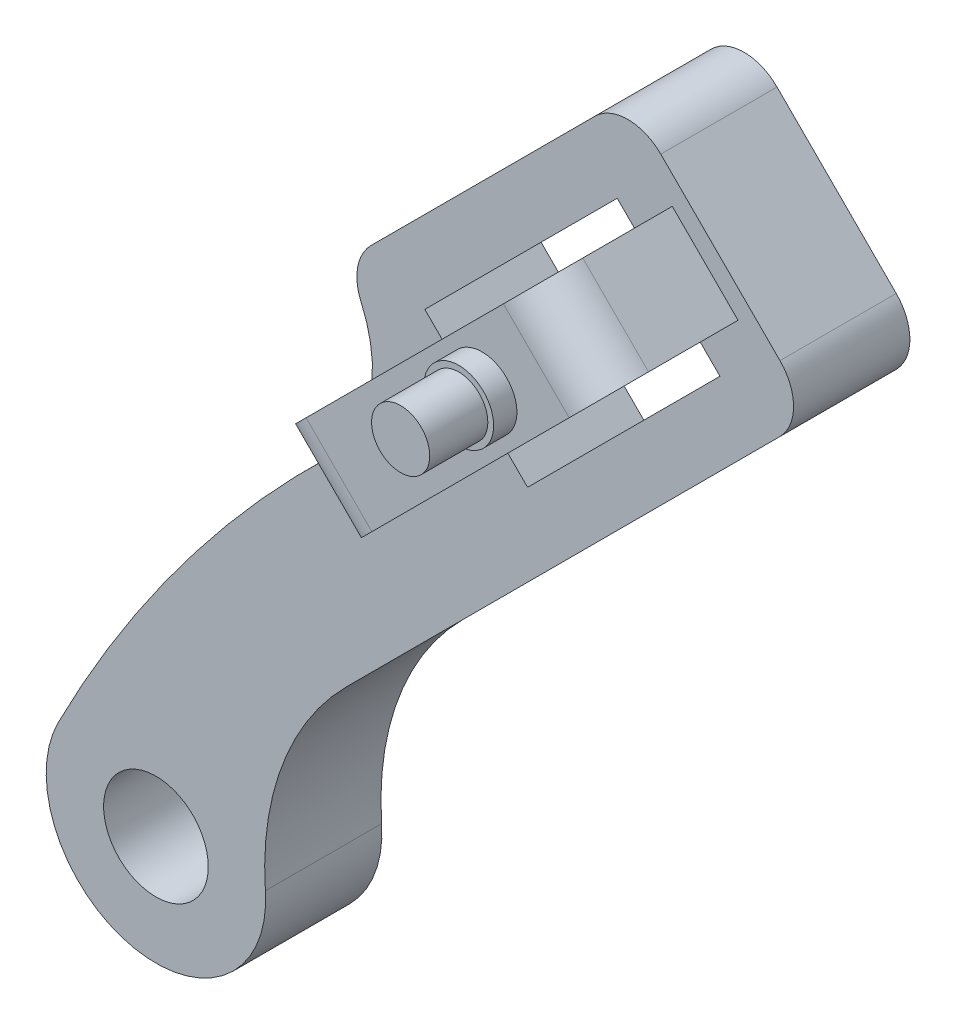
from build123d import *

# Parameters (mm, degrees)
SKETCH_2_R          = 4.5
EXTRUDE_1_DEPTH     = 10
EXTRUDE_2_DEPTH     = 4
SKETCH_12_R         = 0.8
CUT_EXTRUDE_2_DEPTH = 8
SKETCH_13_R         = 3
EXTRUDE_3_DEPTH     = 2
SKETCH_19_R         = 2.5
EXTRUDE_5_DEPTH     = 5


with BuildPart() as part:
    # 草图2 → 凸台-拉伸1 (new body)
    with BuildSketch(Plane.XY):
        with BuildLine():
            Line((7.102160211, -15.616687508), (44.391240582, 21.672392863))
            ThreePointArc((44.391240582, 21.672392863), (45.562813457, 24.500819988), (44.391240582, 27.329247112))
            Line((44.391240582, 27.329247112), (34.138192255, 37.58229544))
            ThreePointArc((34.138192255, 37.58229544), (31.30976513, 38.753868315), (28.481338005, 37.58229544))
            Line((28.481338005, 37.58229544), (9.215390399, 18.316347834))
            ThreePointArc((9.215390399, 18.316347834), (8.067593218, 16.131525495), (8.362136672, 13.681192624))
            ThreePointArc((8.362136672, 13.681192624), (9.134610316, 6.948541986), (5.886174479, 1.001024456))
            ThreePointArc((5.886174479, 1.001024456), (-7.225109998, -13.84439598), (-17.685225472, -30.663381468))
            ThreePointArc((-17.685225472, -30.663381468), (-11.168239652, -44.207967845), (0.129369861, -34.293788928))
            ThreePointArc((0.129369861, -34.293788928), (1.585802578, -24.197384934), (7.102160211, -15.616687508))
        make_face()
        with Locations((-9.283850525, -34.961173895)):
            Circle(SKETCH_2_R, mode=Mode.SUBTRACT)
        Polygon((39.229361079, 23.581581172), (22.6830624, 7.035282492), (13.844227635, 15.874117257), (30.390526315, 32.420415937), align=None, mode=Mode.SUBTRACT)
    extrude(amount=EXTRUDE_1_DEPTH)

    # 草图4 → 凸台-拉伸2 (add, symmetric)
    with BuildSketch(Plane(origin=(3.298406554, -3.298406554, 0), x_dir=(0, 0, -1), z_dir=(0.7071067811865492, -0.7071067811865458, 0))):
        with BuildLine():
            Line((-9.697397979, 20.014043199), (-9.697397979, 17.014043199))
            Line((-9.697397979, 17.014043199), (-17.697397979, 17.014043199))
            ThreePointArc((-17.697397979, 17.014043199), (-20.525825104, 18.185616074), (-21.697397979, 21.014043199))
            Line((-21.697397979, 21.014043199), (-21.697397979, 45.014043199))
            ThreePointArc((-21.697397979, 45.014043199), (-20.525825104, 47.842470323), (-17.697397979, 49.014043199))
            Line((-17.697397979, 49.014043199), (-9.697397979, 49.014043199))
            Line((-9.697397979, 49.014043199), (-9.697397979, 46.014043199))
            Line((-9.697397979, 46.014043199), (-16.697397979, 46.014043199))
            Line((-16.697397979, 46.014043199), (-16.697397979, 20.014043199))
            Line((-16.697397979, 20.014043199), (-9.697397979, 20.014043199))
        make_face()
    extrude(amount=EXTRUDE_2_DEPTH, both=True)

    # 草图12 → 切除-拉伸2 (cut)
    with BuildSketch(Plane(origin=(0, 0, 0), x_dir=(-1, 0, 0), z_dir=(0, 0, -1))):
        with Locations((-16.354456708, 9.7576436)):
            Circle(SKETCH_12_R)
        with Locations((-36.506999972, 29.910186864)):
            Circle(SKETCH_12_R)
    extrude(amount=-CUT_EXTRUDE_2_DEPTH, mode=Mode.SUBTRACT)

    # 草图13 → 凸台-拉伸3 (add)
    with BuildSketch(Plane.XY.offset(21.697397979)):
        with Locations(Location((30.461236993, 23.864423885, 0), (0, 0, 180))):
            Circle(SKETCH_13_R)
    extrude(amount=EXTRUDE_3_DEPTH)

    # 草图19 → 凸台-拉伸5 (add)
    with BuildSketch(Plane.XY.offset(23.697397979)):
        with Locations((30.461236993, 23.864423885)):
            Circle(SKETCH_19_R)
    extrude(amount=EXTRUDE_5_DEPTH)


solid = part.part
